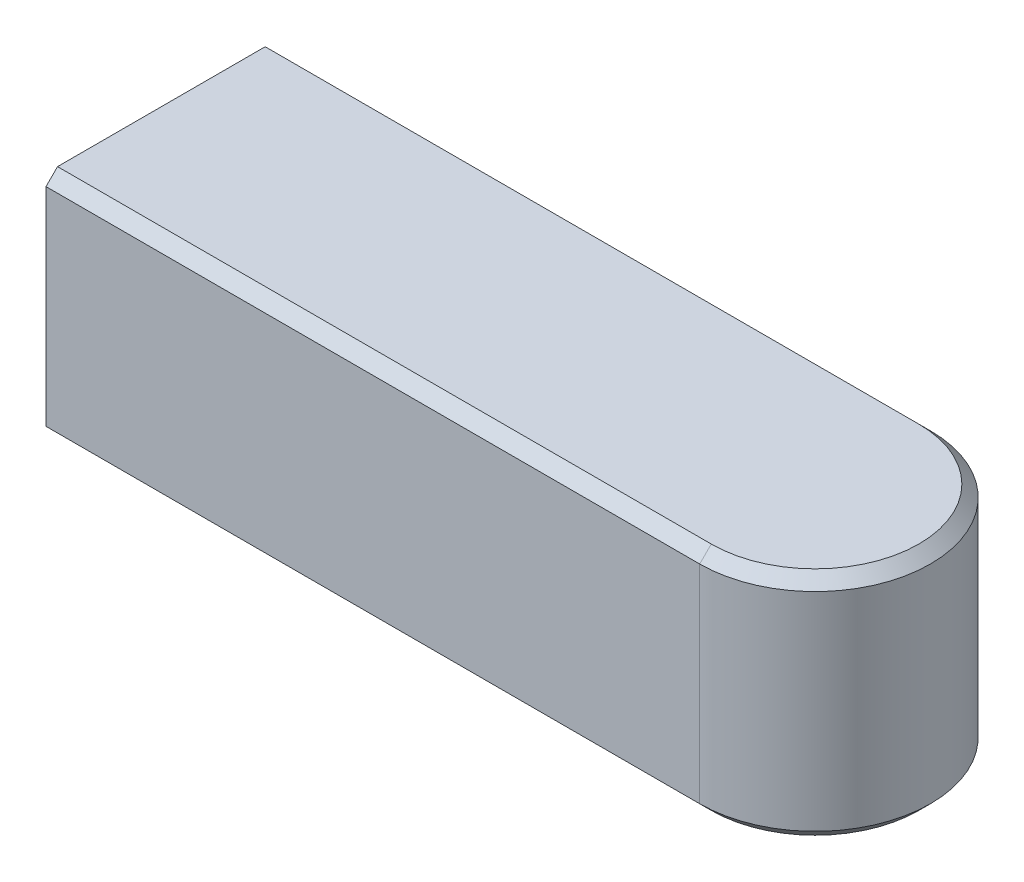
from build123d import *

# Parameters (mm, degrees)
SKETCH1_W           = 20
SKETCH1_H           = 6
BOSS_EXTRUDE1_DEPTH = 6
FILLET2_RADIUS      = 3
FILLET2_LENGTH      = 6
CHAMFER2_SIZE       = 0.3


with BuildPart() as part:
    # Sketch1 → Boss-Extrude1 (new body)
    with BuildSketch(Plane(origin=(0, 0, 0), x_dir=(1, 0, 0), z_dir=(0, 1, 0))):
        Rectangle(SKETCH1_W, SKETCH1_H)
    extrude(amount=BOSS_EXTRUDE1_DEPTH)

    # Fillet2: full round fillet: the end face becomes a half cylinder, R = half its width
    fillet2_face = Plane((10, 3, 0), x_dir=(0, 1, 0), z_dir=(1, 0, 0))  # on the end face: x along it, z out of the body
    fillet2_slab = fillet2_face.offset(-FILLET2_RADIUS / 2) * Box(FILLET2_LENGTH, 2 * FILLET2_RADIUS, FILLET2_RADIUS, mode=Mode.PRIVATE)  # the body's end, R deep
    fillet2_round = Plane((7, 3, 0), x_dir=(1, 0, 0), z_dir=(0, 1, 0)) * Cylinder(FILLET2_RADIUS, FILLET2_LENGTH, mode=Mode.PRIVATE)  # its axis R under the face
    add(fillet2_slab - fillet2_round, mode=Mode.SUBTRACT)

    # Chamfer2
    chamfer2_edges = [part.edges().sort_by_distance(p)[0] for p in [
        (-1.5, 0, -3),
        (-1.5, 6, -3),
        (10, 0, 0),
        (10, 6, 0),
        (-1.5, 0, 3),
        (-1.5, 6, 3),
    ]]
    chamfer(chamfer2_edges, length=CHAMFER2_SIZE)


solid = part.part
